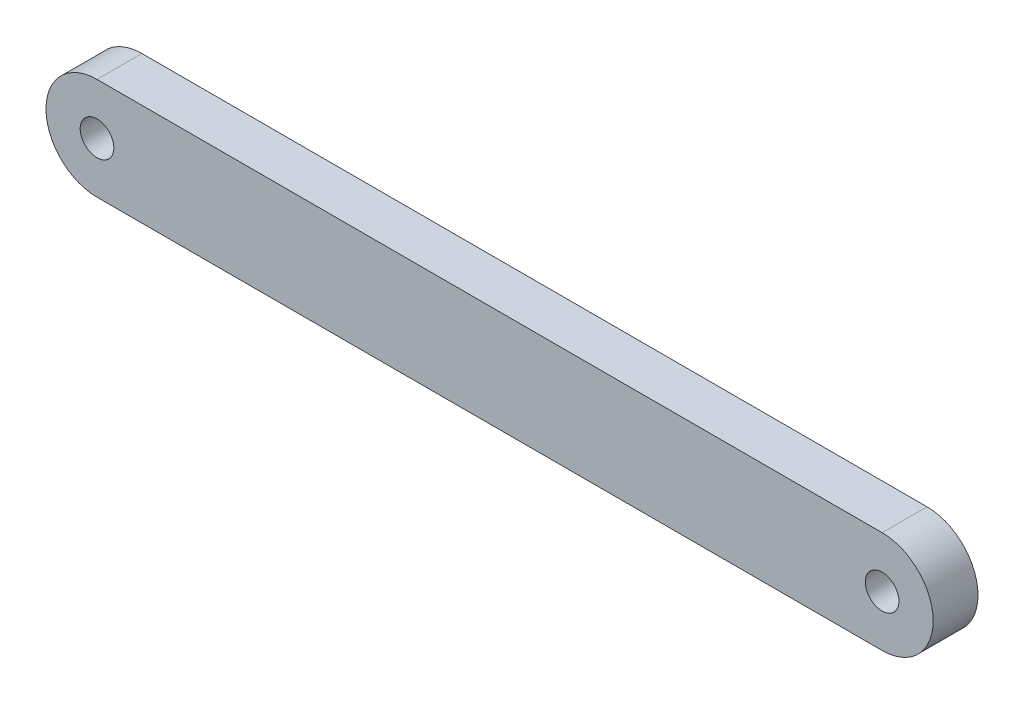
from build123d import *

# Parameters (mm, degrees)
SKETCH1_R           = 0.75
BOSS_EXTRUDE1_DEPTH = 2


with BuildPart() as part:
    # Sketch1 → Boss-Extrude1 (new body)
    with BuildSketch(Plane.XY):
        with BuildLine():
            Line((-17.247292419, 1.453068592), (17.752707581, 1.453068592))
            ThreePointArc((17.752707581, 1.453068592), (20.027075812, -0.821299639), (17.752707581, -3.09566787))
            Line((17.752707581, -3.09566787), (-17.247292419, -3.09566787))
            ThreePointArc((-17.247292419, -3.09566787), (-19.52166065, -0.821299639), (-17.247292419, 1.453068592))
        make_face()
        with Locations((-17.247292419, -0.821299639)):
            Circle(SKETCH1_R, mode=Mode.SUBTRACT)
        with Locations((17.752707581, -0.821299639)):
            Circle(SKETCH1_R, mode=Mode.SUBTRACT)
    extrude(amount=BOSS_EXTRUDE1_DEPTH)


solid = part.part
